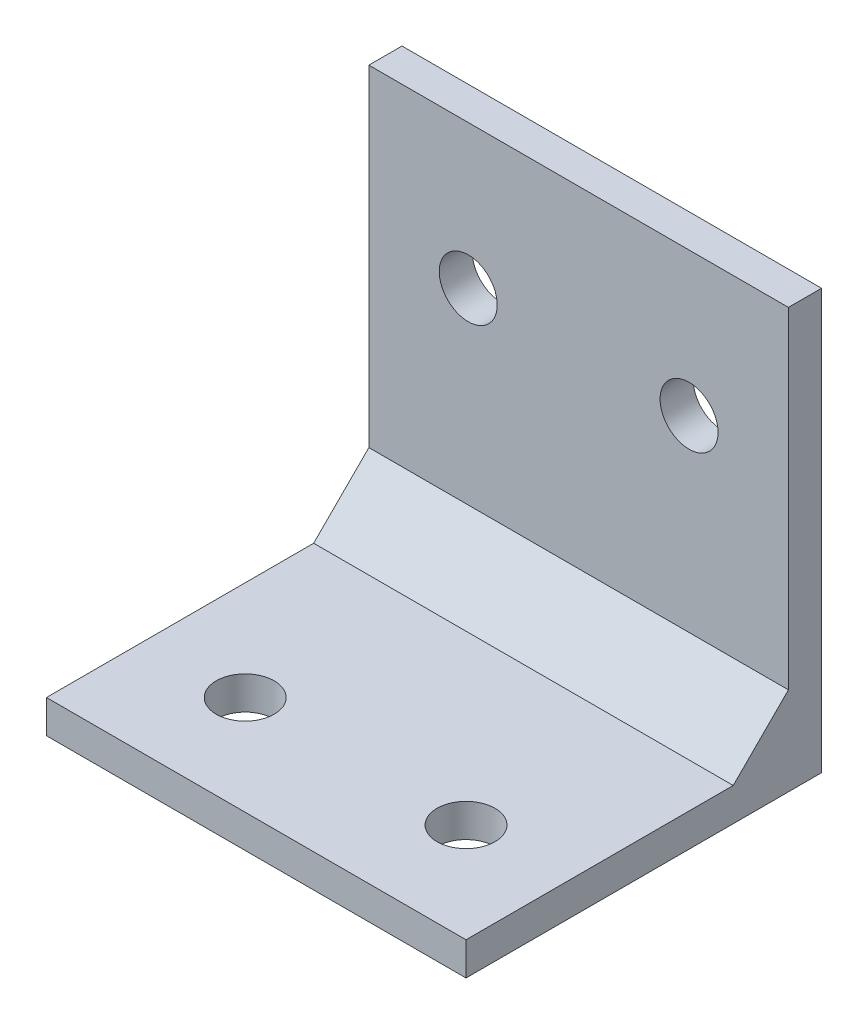
from build123d import *

# Parameters (mm, degrees)
SKETCH1_W           = 38
SKETCH1_H           = 32.2
SKETCH1_R           = 2.625
BOSS_EXTRUDE1_DEPTH = 3
SKETCH2_W           = 38
SKETCH2_H           = 3
BOSS_EXTRUDE2_DEPTH = 35
SKETCH3_R           = 2.625
CUT_EXTRUDE1_DEPTH  = 62.160771741
BOSS_EXTRUDE3_DEPTH = 38


with BuildPart() as part:
    # Sketch1 → Boss-Extrude1 (new body)
    with BuildSketch(Plane(origin=(0, 0, 0), x_dir=(1, 0, 0), z_dir=(0, 1, 0))):
        with Locations((-19, -16.1)):
            Rectangle(SKETCH1_W, SKETCH1_H)
        with Locations(Location((-29, -23.2, 0), (0, 0, 270))):
            Circle(SKETCH1_R, mode=Mode.SUBTRACT)
        with Locations(Location((-9, -23.2, 0), (0, 0, 90))):
            Circle(SKETCH1_R, mode=Mode.SUBTRACT)
    extrude(amount=BOSS_EXTRUDE1_DEPTH)

    # Sketch2 → Boss-Extrude2 (add)
    with BuildSketch(Plane(origin=(0, 3, 0), x_dir=(1, 0, 0), z_dir=(0, 1, 0))):
        with Locations((-19, -1.5)):
            Rectangle(SKETCH2_W, SKETCH2_H)
    extrude(amount=BOSS_EXTRUDE2_DEPTH)

    # Sketch3 → Cut-Extrude1 (cut, through all)
    with BuildSketch(Plane.XY.offset(3)):
        with Locations((-29, 25)):
            Circle(SKETCH3_R)
        with Locations((-9, 25)):
            Circle(SKETCH3_R)
    extrude(amount=-CUT_EXTRUDE1_DEPTH, mode=Mode.SUBTRACT)

    # Sketch4 → Boss-Extrude3 (add, through all)
    with BuildSketch(Plane(origin=(0, 0, 0), x_dir=(0, 0, -1), z_dir=(1, 0, 0))):
        Polygon((-3, 8), (-8, 3), (-3, 3), align=None)
    extrude(amount=-BOSS_EXTRUDE3_DEPTH)


solid = part.part
